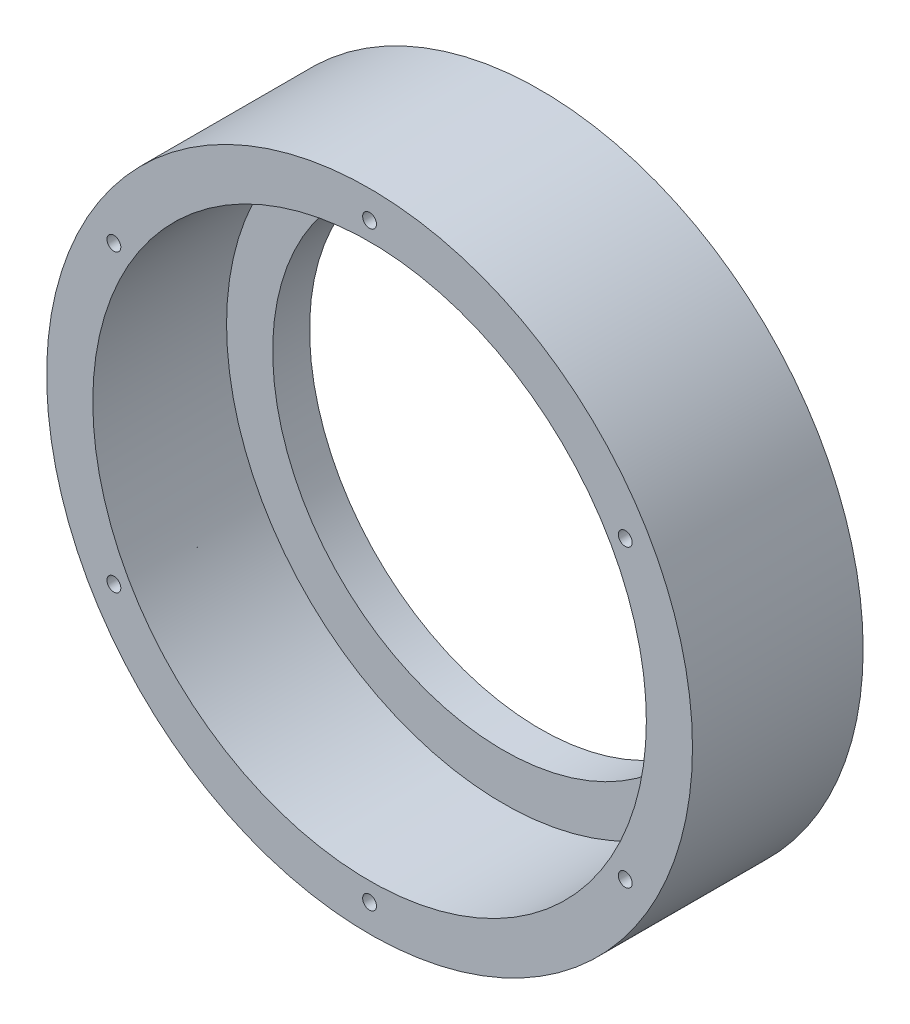
from build123d import *

# Parameters (mm, degrees)
SKETCH1_R           = 60
SKETCH1_R_2         = 50
BOSS_EXTRUDE1_DEPTH = 8
SKETCH2_R           = 70
SKETCH2_R_2         = 60
BOSS_EXTRUDE2_DEPTH = 29
SKETCH3_R           = 1.5
CUT_EXTRUDE2_DEPTH  = 37
SKETCH4_R           = 2.75
CUT_EXTRUDE3_DEPTH  = 3
CIRPATTERN1_COUNT   = 6
BOSS_EXTRUDE3_START = 8
SKETCH7_R           = 70
SKETCH7_R_2         = 60
SKETCH7_R_3         = 2.75
BOSS_EXTRUDE3_DEPTH = 8


with BuildPart() as part:
    # Sketch1 → Boss-Extrude1 (new body)
    with BuildSketch(Plane.XY):
        Circle(SKETCH1_R)
        Circle(SKETCH1_R_2, mode=Mode.SUBTRACT)
    extrude(amount=BOSS_EXTRUDE1_DEPTH)



with BuildPart() as body_2:
    # Sketch2 → Boss-Extrude2 (new body)
    with BuildSketch(Plane.XY.offset(8)):
        with Locations(Location((0, 0, 0), (0, 0, 180))):
            Circle(SKETCH2_R)
        Circle(SKETCH2_R_2, mode=Mode.SUBTRACT)
    extrude(amount=BOSS_EXTRUDE2_DEPTH)

    # Sketch3 → Cut-Extrude2 (cut)
    with BuildSketch(Plane(origin=(0, 0, 8), x_dir=(-1, 0, 0), z_dir=(0, 0, -1))):
        with Locations((0, 64)):
            Circle(SKETCH3_R)
    cut_extrude2 = extrude(amount=-CUT_EXTRUDE2_DEPTH, mode=Mode.SUBTRACT)

    # Sketch4 → Cut-Extrude3 (cut)
    with BuildSketch(Plane(origin=(0, 0, 8), x_dir=(-1, 0, 0), z_dir=(0, 0, -1))):
        with Locations((0, 64)):
            Circle(SKETCH4_R)
    cut_extrude3 = extrude(amount=-CUT_EXTRUDE3_DEPTH, mode=Mode.SUBTRACT)

    # CirPattern1: Cut-Extrude2, Cut-Extrude3 ×6 about axis
    cirpattern1_axis = Axis((0, 0, 0), (0, 0, 1))
    add([cut_extrude2.rotate(cirpattern1_axis, i * 360 / CIRPATTERN1_COUNT) for i in range(1, CIRPATTERN1_COUNT)], mode=Mode.SUBTRACT)
    add([cut_extrude3.rotate(cirpattern1_axis, i * 360 / CIRPATTERN1_COUNT) for i in range(1, CIRPATTERN1_COUNT)], mode=Mode.SUBTRACT)


with BuildPart() as part_1:
    add(part.part)

    add(body_2.part)  # Boss-Extrude3 merges body 2
    # Sketch7 → Boss-Extrude3 (add)
    with BuildSketch(Plane(origin=(0, 0, 8), x_dir=(-1, 0, 0), z_dir=(0, 0, -1)).offset(BOSS_EXTRUDE3_START)):
        with Locations(Location((0, 0, 0), (0, 0, 180))):
            Circle(SKETCH7_R)
        Circle(SKETCH7_R_2, mode=Mode.SUBTRACT)
        with Locations((0, 64)):
            Circle(SKETCH7_R_3, mode=Mode.SUBTRACT)
        with Locations(Location((-55.425625842, 32, 0), (0, 0, 60))):
            Circle(SKETCH7_R_3, mode=Mode.SUBTRACT)
        with Locations(Location((-55.425625842, -32, 0), (0, 0, 120))):
            Circle(SKETCH7_R_3, mode=Mode.SUBTRACT)
        with Locations(Location((0, -64, 0), (0, 0, 180))):
            Circle(SKETCH7_R_3, mode=Mode.SUBTRACT)
        with Locations(Location((55.425625842, -32, 0), (0, 0, 240))):
            Circle(SKETCH7_R_3, mode=Mode.SUBTRACT)
        with Locations(Location((55.425625842, 32, 0), (0, 0, 300))):
            Circle(SKETCH7_R_3, mode=Mode.SUBTRACT)
    extrude(amount=-BOSS_EXTRUDE3_DEPTH)


solid = part_1.part
